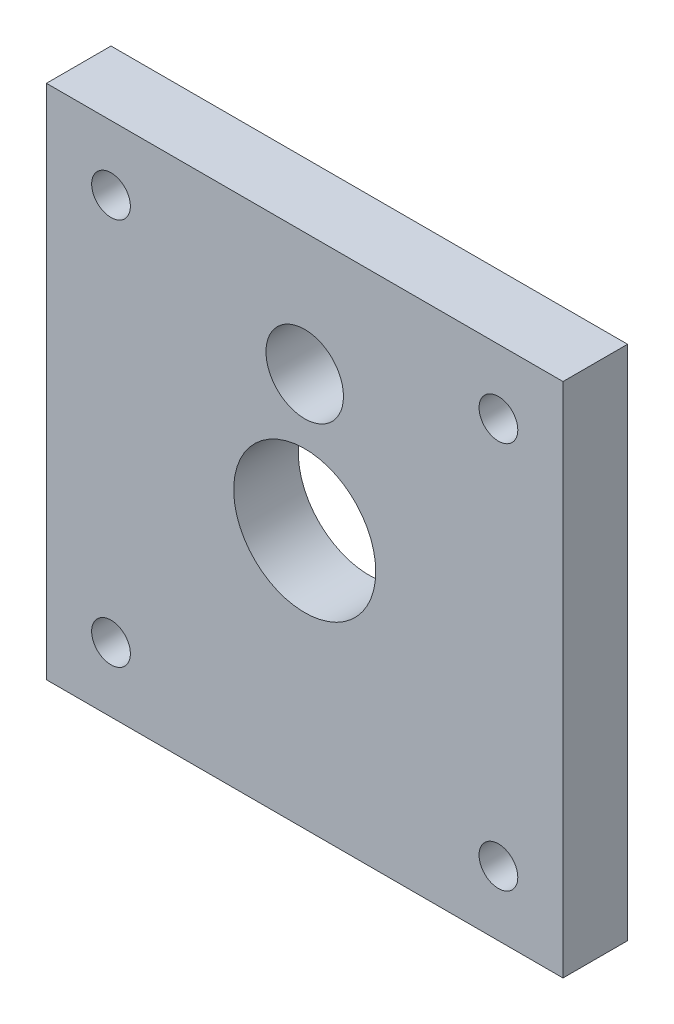
from build123d import *

# Parameters (mm, degrees)
SKETCH_1_W      = 40
SKETCH_1_H      = 40
SKETCH_1_R      = 5.5
SKETCH_1_R_2    = 3
SKETCH_1_R_3    = 1.5
EXTRUDE_1_DEPTH = 5


with BuildPart() as part:
    # 草图1 → 凸台-拉伸1 (new body)
    with BuildSketch(Plane.XY):
        Rectangle(SKETCH_1_W, SKETCH_1_H)
        Circle(SKETCH_1_R, mode=Mode.SUBTRACT)
        with Locations((0, 10.5)):
            Circle(SKETCH_1_R_2, mode=Mode.SUBTRACT)
        with Locations((-15, 15)):
            Circle(SKETCH_1_R_3, mode=Mode.SUBTRACT)
        with Locations((15, 15)):
            Circle(SKETCH_1_R_3, mode=Mode.SUBTRACT)
        with Locations((15, -15)):
            Circle(SKETCH_1_R_3, mode=Mode.SUBTRACT)
        with Locations((-15, -15)):
            Circle(SKETCH_1_R_3, mode=Mode.SUBTRACT)
    extrude(amount=EXTRUDE_1_DEPTH)


solid = part.part
